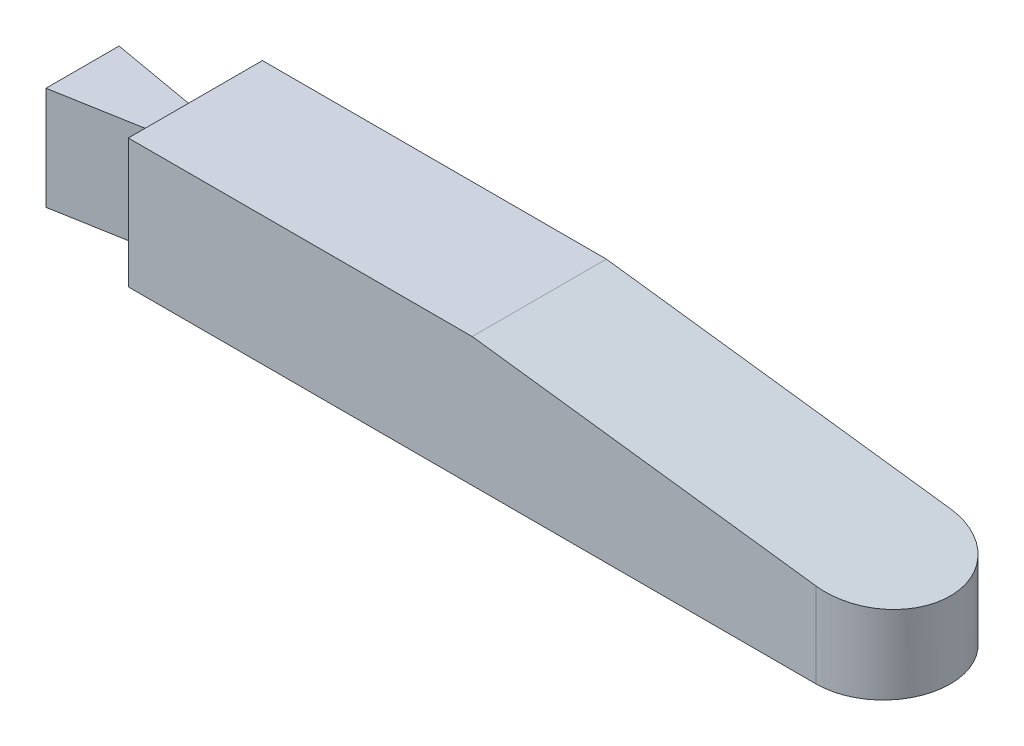
from build123d import *

# Parameters (mm, degrees)
BOSS_EXTRUDE1_DEPTH = 38.1
CUT_EXTRUDE1_DEPTH  = 7.62
CUT_EXTRUDE4_DEPTH  = 39.624


with BuildPart() as part:
    # Sketch2 → Boss-Extrude1 (new body)
    with BuildSketch(Plane(origin=(0, 0, 0), x_dir=(1, 0, 0), z_dir=(0, 1, 0))):
        with BuildLine():
            Line((-13.549240888, -12.227712799), (-13.549240888, -33.817712799))
            Line((-13.549240888, -33.817712799), (18.962759112, -28.084970002))
            Line((18.962759112, -28.084970002), (18.962759112, -42.01258333))
            Line((18.962759112, -42.01258333), (222.162759112, -42.01258333))
            ThreePointArc((222.162759112, -42.01258333), (241.974759112, -22.20058333), (222.162759112, -2.38858333))
            Line((222.162759112, -2.38858333), (18.962759112, -2.38858333))
            Line((18.962759112, -2.38858333), (18.962759112, -17.960455596))
            Line((18.962759112, -17.960455596), (-13.549240888, -12.227712799))
        make_face()
    extrude(amount=BOSS_EXTRUDE1_DEPTH)

    # Sketch3 → Cut-Extrude1 (cut)
    with BuildSketch(Plane(origin=(0, 38.1, 0), x_dir=(1, 0, 0), z_dir=(0, 1, 0))):
        Polygon((-13.549240888, -12.227712799), (-13.549240888, -33.817712799), (18.962759112, -28.084970002), (18.962759112, -17.960455596), align=None)
    extrude(amount=-CUT_EXTRUDE1_DEPTH, mode=Mode.SUBTRACT)

    # Sketch5 → Cut-Extrude4 (cut)
    with BuildSketch(Plane.XY.offset(42.01258333)):
        Polygon((120.562759112, 38.1), (241.974759112, 22.519655205), (241.974759112, 38.1), align=None)
    extrude(amount=-CUT_EXTRUDE4_DEPTH, mode=Mode.SUBTRACT)


solid = part.part
